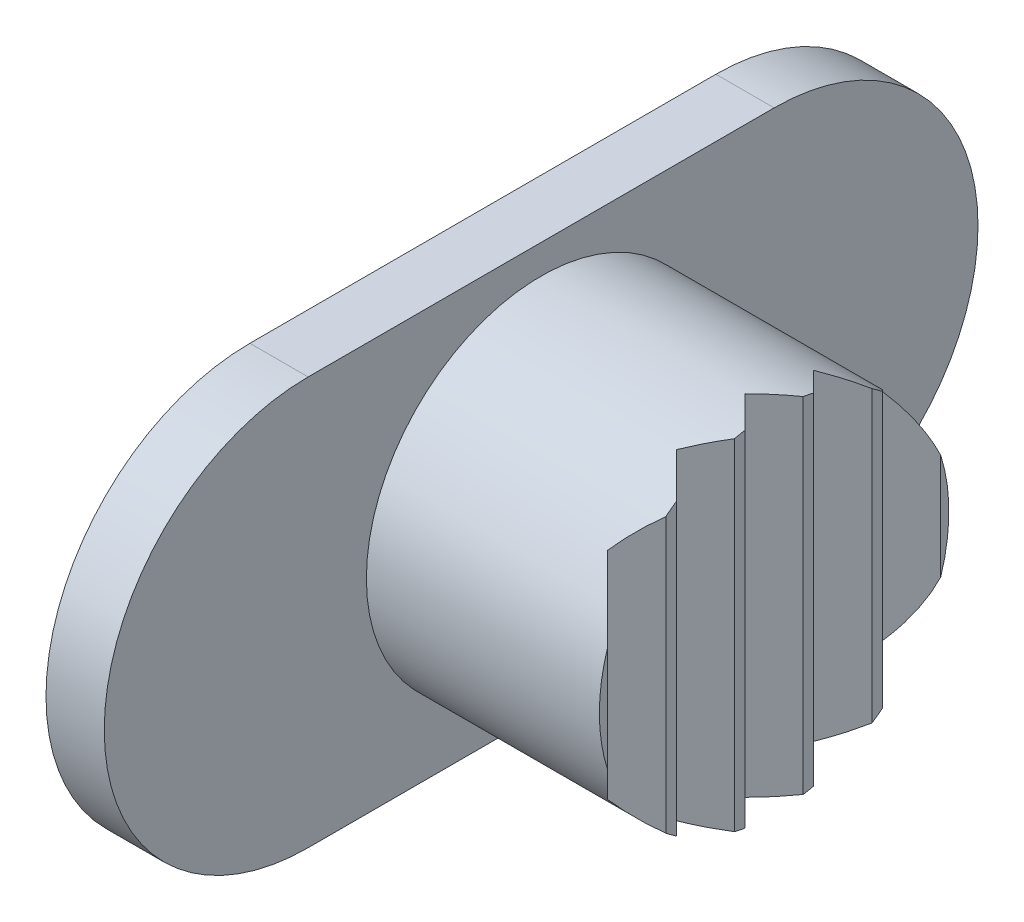
from build123d import *

# Parameters (mm, degrees)
SKETCH1_R               = 3
SKETCH1_W               = 3.6
SKETCH1_H               = 3.6
BOSS_EXTRUDE1_DEPTH     = 4
SKETCH2_W               = 3.6
SKETCH2_H               = 3.6
BOSS_EXTRUDE2_DEPTH     = 1
SKETCH3_R               = 3
BOSS_EXTRUDE3_DEPTH     = 1
CUT_EXTRUDE2_DEPTH      = 10.669539803
CUT_EXTRUDE2_DEPTH_BACK = 10.669539803


with BuildPart() as part:
    # Sketch1 → Boss-Extrude1 (new body)
    with BuildSketch(Plane(origin=(0, 0, 0), x_dir=(0, 0, -1), z_dir=(1, 0, 0))):
        Circle(SKETCH1_R)
        Rectangle(SKETCH1_W, SKETCH1_H, mode=Mode.SUBTRACT)
    extrude(amount=BOSS_EXTRUDE1_DEPTH)

    # Sketch2 → Boss-Extrude2 (add)
    with BuildSketch(Plane.ZY):
        with BuildLine():
            Line((-4, 3.5), (4, 3.5))
            ThreePointArc((4, 3.5), (7.5, 0), (4, -3.5))
            Line((4, -3.5), (-4, -3.5))
            ThreePointArc((-4, -3.5), (-7.5, 0), (-4, 3.5))
        make_face()
        Rectangle(SKETCH2_W, SKETCH2_H, mode=Mode.SUBTRACT)
    extrude(amount=-BOSS_EXTRUDE2_DEPTH)

    # Sketch3 → Boss-Extrude3 (add)
    with BuildSketch(Plane(origin=(4, 0, 0), x_dir=(0, 0, -1), z_dir=(1, 0, 0))):
        with Locations(Location((0, 0, 0), (0, 0, 180))):
            Circle(SKETCH3_R)
    extrude(amount=BOSS_EXTRUDE3_DEPTH)

    # Sketch5 → Cut-Extrude2 (cut, two sides: drawn at the far end of the back side and taken through both)
    with BuildSketch(Plane(origin=(0, 0, 0), x_dir=(1, 0, 0), z_dir=(0, 1, 0)).offset(-CUT_EXTRUDE2_DEPTH_BACK)):
        Polygon((5, 2.86), (4.5, 2.36), (5, 1.86), align=None)
        Polygon((5, 1.68), (4.5, 1.18), (5, 0.68), align=None)
        Polygon((5, 0.5), (4.5, 0), (5, -0.5), align=None)
        Polygon((5, -0.68), (4.5, -1.18), (5, -1.68), align=None)
        Polygon((5, -1.86), (4.5, -2.36), (5, -2.86), align=None)
    extrude(amount=CUT_EXTRUDE2_DEPTH + CUT_EXTRUDE2_DEPTH_BACK, mode=Mode.SUBTRACT)


solid = part.part
